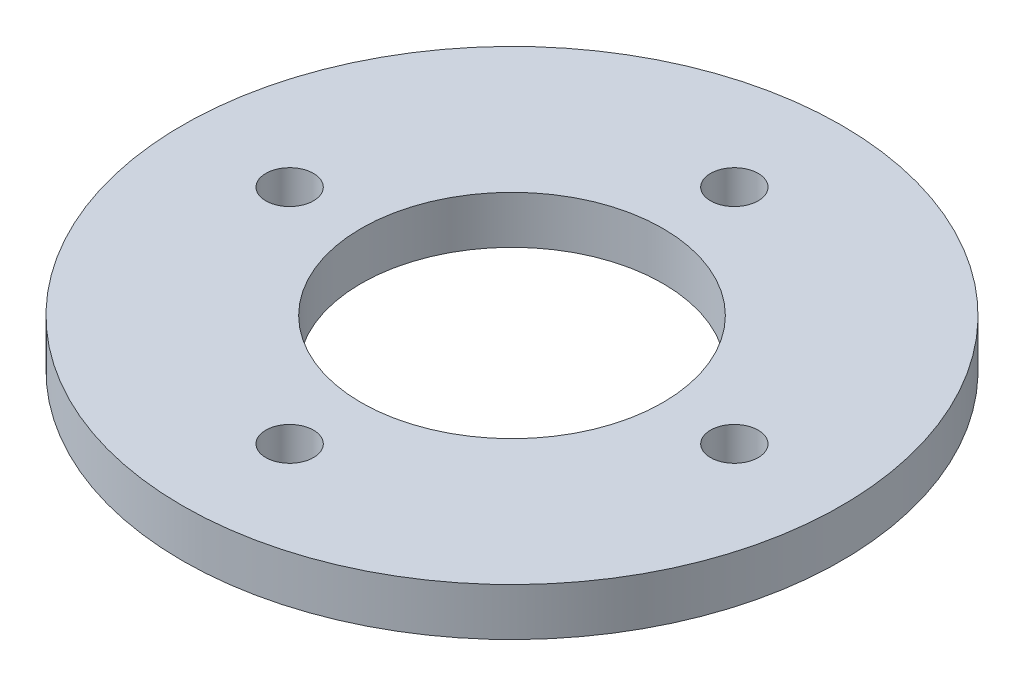
from build123d import *

# Parameters (mm, degrees)
SKETCH_1_R      = 20.75
SKETCH_1_R_2    = 1.5
SKETCH_1_R_3    = 9.5
EXTRUDE_2_DEPTH = 3


with BuildPart() as part:
    # 草图1 → 凸台-拉伸2 (new body)
    with BuildSketch(Plane(origin=(0, 0, 0), x_dir=(1, 0, 0), z_dir=(0, 1, 0))):
        with Locations(Location((0, 0, 0), (0, 0, 270))):
            Circle(SKETCH_1_R)
        with Locations(Location((0, 14, 0), (0, 0, 270))):
            Circle(SKETCH_1_R_2, mode=Mode.SUBTRACT)
        with Locations(Location((-14, 0, 0), (0, 0, 270))):
            Circle(SKETCH_1_R_2, mode=Mode.SUBTRACT)
        with Locations(Location((0, -14, 0), (0, 0, 270))):
            Circle(SKETCH_1_R_2, mode=Mode.SUBTRACT)
        with Locations(Location((14, 0, 0), (0, 0, 270))):
            Circle(SKETCH_1_R_2, mode=Mode.SUBTRACT)
        with Locations(Location((0, 0, 0), (0, 0, 270))):
            Circle(SKETCH_1_R_3, mode=Mode.SUBTRACT)
    extrude(amount=EXTRUDE_2_DEPTH)


solid = part.part
